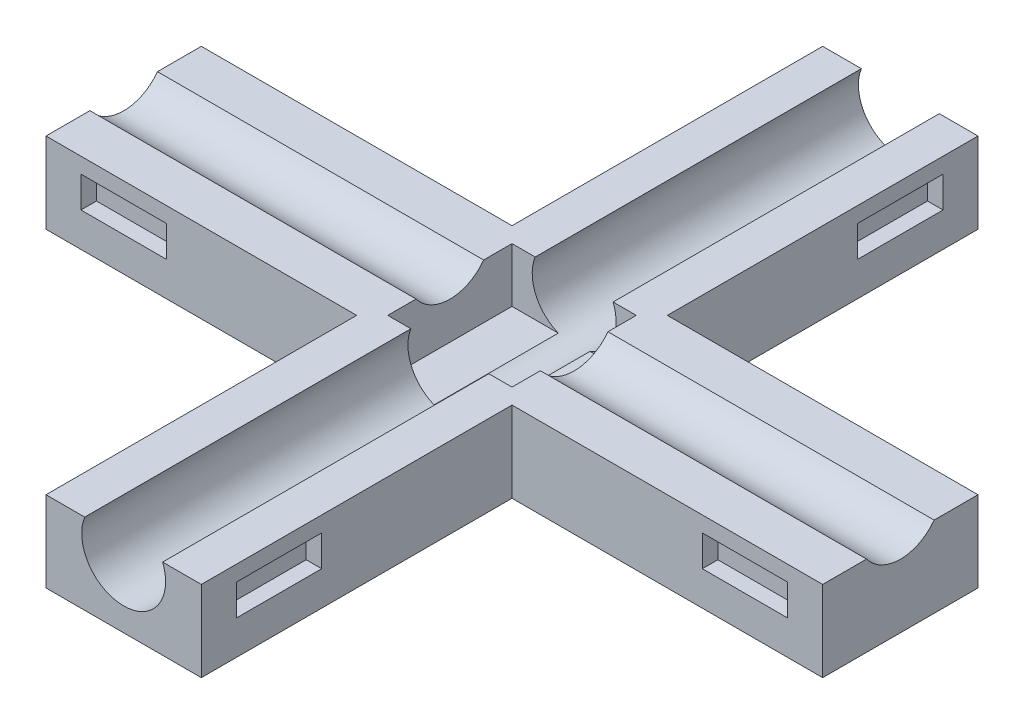
from build123d import *

# Parameters (mm, degrees)
BOSS_EXTRUDE5_DEPTH         = 5.2
CUT_EXTRUDE1_REACH          = 58.143
SKETCH4_R                   = 2.7
SKETCH5_R                   = 2.7
CUT_EXTRUDE2_DEPTH          = 57.143031625
SKETCH6_W                   = 8
SKETCH6_H                   = 8
CUT_EXTRUDE3_DEPTH          = 3.5
SKETCH7_W                   = 5.5
SKETCH7_H                   = 2
CUT_EXTRUDE4_DEPTH          = 1
CIRPATTERN1_COPY_1_SKETCH_W = 5.5
CIRPATTERN1_COPY_1_SKETCH_H = 2
CIRPATTERN1_COPY_1_DEPTH    = 1
CIRPATTERN1_COPY_2_SKETCH_W = 5.5
CIRPATTERN1_COPY_2_SKETCH_H = 2
CIRPATTERN1_COPY_2_DEPTH    = 1
CIRPATTERN1_COPY_3_SKETCH_W = 5.5
CIRPATTERN1_COPY_3_SKETCH_H = 2
CIRPATTERN1_COPY_3_DEPTH    = 1
CIRPATTERN1_COPY_4_SKETCH_W = 5.5
CIRPATTERN1_COPY_4_SKETCH_H = 2
CIRPATTERN1_COPY_4_DEPTH    = 1
CIRPATTERN1_COPY_5_SKETCH_W = 5.5
CIRPATTERN1_COPY_5_SKETCH_H = 2
CIRPATTERN1_COPY_5_DEPTH    = 1
CIRPATTERN1_COPY_6_SKETCH_W = 5.5
CIRPATTERN1_COPY_6_SKETCH_H = 2
CIRPATTERN1_COPY_6_DEPTH    = 1


with BuildPart() as part:
    # Sketch3 → Boss-Extrude5 (new body)
    with BuildSketch(Plane(origin=(0, 0, 0), x_dir=(1, 0, 0), z_dir=(0, 1, 0))):
        Polygon((5, 5), (25, 5), (25, -5), (5, -5), (5, -25), (-5, -25), (-5, -5), (-25, -5), (-25, 5), (-5, 5), (-5, 25), (5, 25), align=None)
    extrude(amount=BOSS_EXTRUDE5_DEPTH)

    # Sketch4 → Cut-Extrude1 (cut, up to next)
    with BuildSketch(Plane.XY.offset(25), mode=Mode.PRIVATE) as cut_extrude1_sk1:
        with Locations((0, 4.2)):
            Circle(SKETCH4_R)
    cut_extrude1_tool1 = extrude(cut_extrude1_sk1.sketch, amount=-CUT_EXTRUDE1_REACH, mode=Mode.PRIVATE) & part.part
    add(cut_extrude1_tool1.solids().sort_by_distance((0, 4.2, 25))[0], mode=Mode.SUBTRACT)

    # Sketch5 → Cut-Extrude2 (cut, through all)
    with BuildSketch(Plane(origin=(25, 0, 0), x_dir=(0, 0, -1), z_dir=(1, 0, 0))):
        with Locations((0, 6.8)):
            Circle(SKETCH5_R)
    extrude(amount=-CUT_EXTRUDE2_DEPTH, mode=Mode.SUBTRACT)

    # Sketch6 → Cut-Extrude3 (cut)
    with BuildSketch(Plane(origin=(0, 5.2, 0), x_dir=(1, 0, 0), z_dir=(0, 1, 0))):
        Rectangle(SKETCH6_W, SKETCH6_H)
    extrude(amount=-CUT_EXTRUDE3_DEPTH, mode=Mode.SUBTRACT)

    # Sketch7 → Cut-Extrude4 (cut)
    with BuildSketch(Plane.XY.offset(5)):
        with Locations((20, 3.2)):
            Rectangle(SKETCH7_W, SKETCH7_H)
    cut_extrude4 = extrude(amount=-CUT_EXTRUDE4_DEPTH, mode=Mode.SUBTRACT)

    # Mirror1: Cut-Extrude4 across plane
    add(cut_extrude4.mirror(Plane.XY), mode=Mode.SUBTRACT)

    # CirPattern1 copy 1 sketch → CirPattern1 copy 1 (cut)
    with BuildSketch(Plane(origin=(5, 0, 0), x_dir=(0, 0, 1), z_dir=(1, 0, 0))):
        with Locations((20, -3.2)):
            Rectangle(CIRPATTERN1_COPY_1_SKETCH_W, CIRPATTERN1_COPY_1_SKETCH_H)
    extrude(amount=-CIRPATTERN1_COPY_1_DEPTH, mode=Mode.SUBTRACT)

    # CirPattern1 copy 2 sketch → CirPattern1 copy 2 (cut)
    with BuildSketch(Plane(origin=(0, 0, 5), x_dir=(-1, 0, 0), z_dir=(0, 0, 1))):
        with Locations((20, -3.2)):
            Rectangle(CIRPATTERN1_COPY_2_SKETCH_W, CIRPATTERN1_COPY_2_SKETCH_H)
    extrude(amount=-CIRPATTERN1_COPY_2_DEPTH, mode=Mode.SUBTRACT)

    # CirPattern1 copy 3 sketch → CirPattern1 copy 3 (cut)
    with BuildSketch(Plane(origin=(-5, 0, 0), x_dir=(0, 0, -1), z_dir=(-1, 0, 0))):
        with Locations((20, -3.2)):
            Rectangle(CIRPATTERN1_COPY_3_SKETCH_W, CIRPATTERN1_COPY_3_SKETCH_H)
    extrude(amount=-CIRPATTERN1_COPY_3_DEPTH, mode=Mode.SUBTRACT)

    # CirPattern1 copy 4 sketch → CirPattern1 copy 4 (cut)
    with BuildSketch(Plane.ZY.offset(5)):
        with Locations((20, 3.2)):
            Rectangle(CIRPATTERN1_COPY_4_SKETCH_W, CIRPATTERN1_COPY_4_SKETCH_H)
    extrude(amount=-CIRPATTERN1_COPY_4_DEPTH, mode=Mode.SUBTRACT)

    # CirPattern1 copy 5 sketch → CirPattern1 copy 5 (cut)
    with BuildSketch(Plane(origin=(0, 0, -5), x_dir=(-1, 0, 0), z_dir=(0, 0, -1))):
        with Locations((20, 3.2)):
            Rectangle(CIRPATTERN1_COPY_5_SKETCH_W, CIRPATTERN1_COPY_5_SKETCH_H)
    extrude(amount=-CIRPATTERN1_COPY_5_DEPTH, mode=Mode.SUBTRACT)

    # CirPattern1 copy 6 sketch → CirPattern1 copy 6 (cut)
    with BuildSketch(Plane(origin=(5, 0, 0), x_dir=(0, 0, -1), z_dir=(1, 0, 0))):
        with Locations((20, 3.2)):
            Rectangle(CIRPATTERN1_COPY_6_SKETCH_W, CIRPATTERN1_COPY_6_SKETCH_H)
    extrude(amount=-CIRPATTERN1_COPY_6_DEPTH, mode=Mode.SUBTRACT)


solid = part.part
